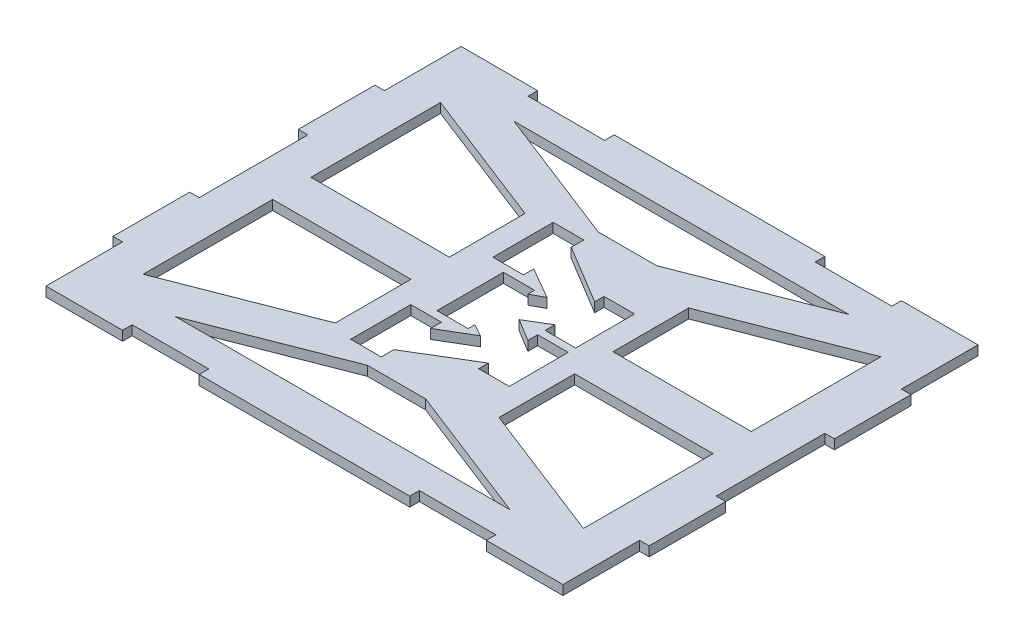
from build123d import *

# Parameters (mm, degrees)
BOSS_EXTRUDE1_DEPTH = 3.175


with BuildPart() as part:
    # Sketch1 → Boss-Extrude1 (new body)
    with BuildSketch(Plane(origin=(0, 0, 0), x_dir=(1, 0, 0), z_dir=(0, 1, 0))):
        Polygon((-60.325, 68.834), (-85.725, 68.834), (-85.725, 43.434), (-88.9, 43.434), (-88.9, 18.034), (-85.725, 18.034), (-85.725, -18.034), (-88.9, -18.034), (-88.9, -43.434), (-85.725, -43.434), (-85.725, -68.834), (-60.325, -68.834), (-60.325, -65.659), (-34.925, -65.659), (-34.925, -68.834), (34.925, -68.834), (34.925, -65.659), (60.325, -65.659), (60.325, -68.834), (85.725, -68.834), (85.725, -43.434), (88.9, -43.434), (88.9, -18.034), (85.725, -18.034), (85.725, 18.034), (88.9, 18.034), (88.9, 43.434), (85.725, 43.434), (85.725, 68.834), (60.325, 68.834), (60.325, 65.659), (34.925, 65.659), (34.925, 68.834), (-34.925, 68.834), (-34.925, 65.659), (-60.325, 65.659), align=None)
        Polygon((-55.514400942, -56.134), (-9.641329679, -38.283634289), (9.641329679, -38.283634289), (55.514400942, -56.134), align=None, mode=Mode.SUBTRACT)
        Polygon((-27.151928737, -31.469819814), (-73.025, -49.320185525), (-73.025, -6.35), (-27.151928737, -6.35), align=None, mode=Mode.SUBTRACT)
        Polygon((0.606600295, 10.984138701), (-9.775001271, 16.993576732), (-9.775001271, 13.565679079), (-19.916767041, 13.565679079), (-19.916767041, 33.572617007), (-9.775001271, 33.572617007), (-9.775001271, 29.423230301), (9.770947304, 17.65448668), (9.770947304, 20.757112988), (19.912713073, 20.757112988), (19.912713073, 1.211164414), (9.770947304, 1.211164414), (9.770947304, 4.412046261), (2.366430033, 0), (9.770947304, -4.510587766), (9.770947304, -1.278178094), (19.912713073, -1.278178094), (19.912713073, -20.824126668), (9.770947304, -20.824126668), (9.770947304, -17.582605044), (-9.775001271, -29.404975555), (-9.775001271, -33.584778117), (-19.916767041, -33.584778117), (-19.916767041, -13.646113818), (-9.775001271, -13.646113818), (-9.775001271, -17.213122569), (0.606600295, -11.051152381), (-3.505546068, -8.798640388), (-3.505546068, -11.051152381), (-13.831707579, -11.051152381), (-13.831707579, 10.984138701), (-3.505546068, 10.984138701), (-3.505546068, 8.762018077), align=None, mode=Mode.SUBTRACT)
        Polygon((73.025, -6.35), (73.025, -49.320185525), (27.151928737, -31.469819814), (27.151928737, -6.35), align=None, mode=Mode.SUBTRACT)
        Polygon((-73.025, 49.320185525), (-27.151928737, 31.469819814), (-27.151928737, 6.35), (-73.025, 6.35), align=None, mode=Mode.SUBTRACT)
        Polygon((27.151928737, 6.35), (27.151928737, 31.469819814), (73.025, 49.320185525), (73.025, 6.35), align=None, mode=Mode.SUBTRACT)
        Polygon((9.641329679, 38.283634289), (-9.641329679, 38.283634289), (-55.514400942, 56.134), (55.514400942, 56.134), align=None, mode=Mode.SUBTRACT)
    extrude(amount=BOSS_EXTRUDE1_DEPTH)


solid = part.part
